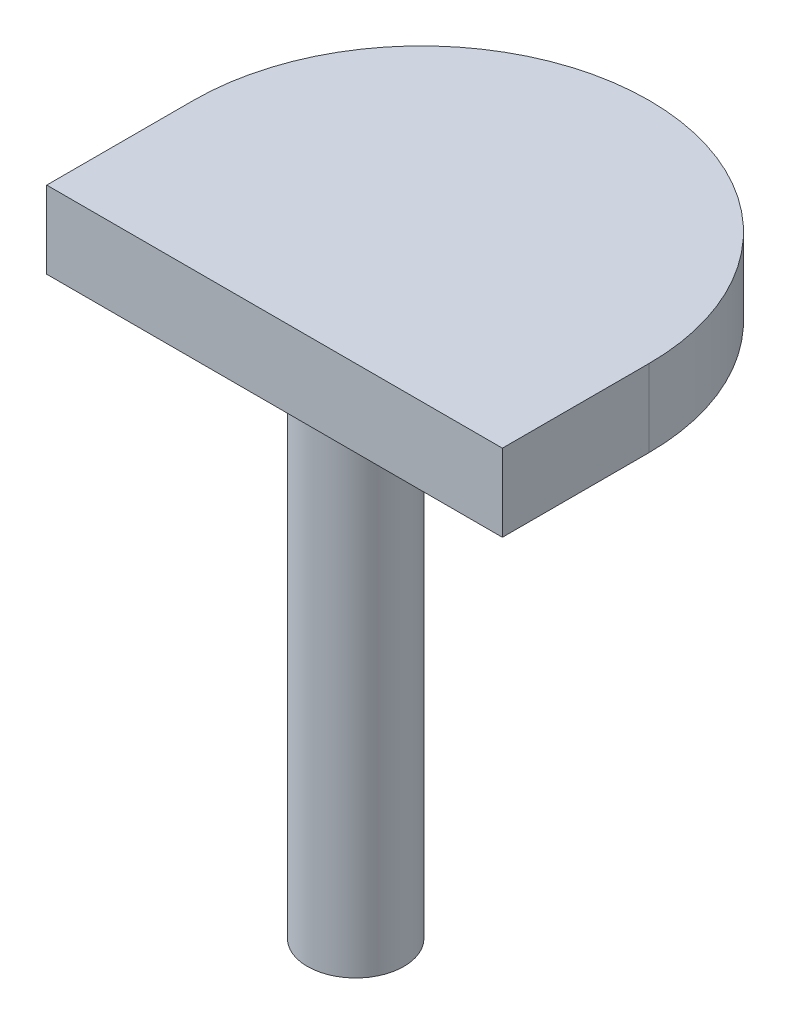
from build123d import *

# Parameters (mm, degrees)
SKETCH1_R                = 1.25
BOSS_EXTRUDE1_DEPTH      = 14
BOSS_EXTRUDE2_DEPTH      = 1
BOSS_EXTRUDE2_DEPTH_BACK = 1
SKETCH3_W                = 11.8
SKETCH3_H                = 3.8
BOSS_EXTRUDE3_DEPTH      = 2


with BuildPart() as part:
    # Sketch1 → Boss-Extrude1 (new body)
    with BuildSketch(Plane(origin=(0, 0, 0), x_dir=(1, 0, 0), z_dir=(0, 1, 0))):
        with Locations(Location((0, 0, 0), (0, 0, 270))):
            Circle(SKETCH1_R)
    extrude(amount=BOSS_EXTRUDE1_DEPTH)

    # Sketch3 → Boss-Extrude2 (add, two sides: drawn at the far end of the back side and taken through both)
    with BuildSketch(Plane(origin=(0, 14, 0), x_dir=(1, 0, 0), z_dir=(0, 1, 0)).offset(-BOSS_EXTRUDE2_DEPTH_BACK)):
        with Locations((1e-09, -0.2)):
            Rectangle(SKETCH3_W, SKETCH3_H)
    extrude(amount=BOSS_EXTRUDE2_DEPTH + BOSS_EXTRUDE2_DEPTH_BACK)

    # Sketch4 → Boss-Extrude3 (add)
    with BuildSketch(Plane(origin=(0, 15, 0), x_dir=(1, 0, 0), z_dir=(0, 1, 0))):
        with BuildLine():
            Line((5.900000001, 1.7), (-5.899999999, 1.7))
            ThreePointArc((-5.899999999, 1.7), (1e-09, 7.6), (5.900000001, 1.7))
        make_face()
    extrude(amount=-BOSS_EXTRUDE3_DEPTH)


solid = part.part
